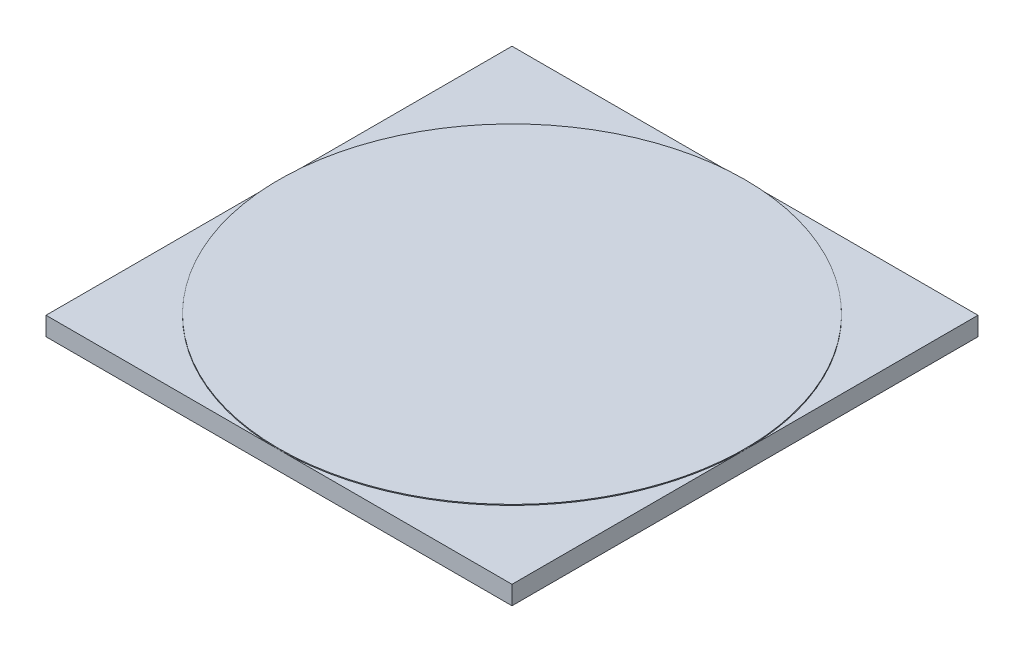
from build123d import *

# Parameters (mm, degrees)
SKETCH1_W           = 50
SKETCH1_H           = 50
BOSS_EXTRUDE1_DEPTH = 2
SKETCH2_R           = 25
BOSS_EXTRUDE2_DEPTH = 0.1


with BuildPart() as part:
    # Sketch1 → Boss-Extrude1 (new body)
    with BuildSketch(Plane(origin=(0, 0, 0), x_dir=(1, 0, 0), z_dir=(0, 1, 0))):
        with Locations((25, 25)):
            Rectangle(SKETCH1_W, SKETCH1_H)
    extrude(amount=BOSS_EXTRUDE1_DEPTH)

    # Sketch2 → Boss-Extrude2 (add)
    with BuildSketch(Plane(origin=(0, 2, 0), x_dir=(1, 0, 0), z_dir=(0, 1, 0))):
        with Locations(Location((25, 25, 0), (0, 0, 270))):
            Circle(SKETCH2_R)
    extrude(amount=BOSS_EXTRUDE2_DEPTH)


solid = part.part
